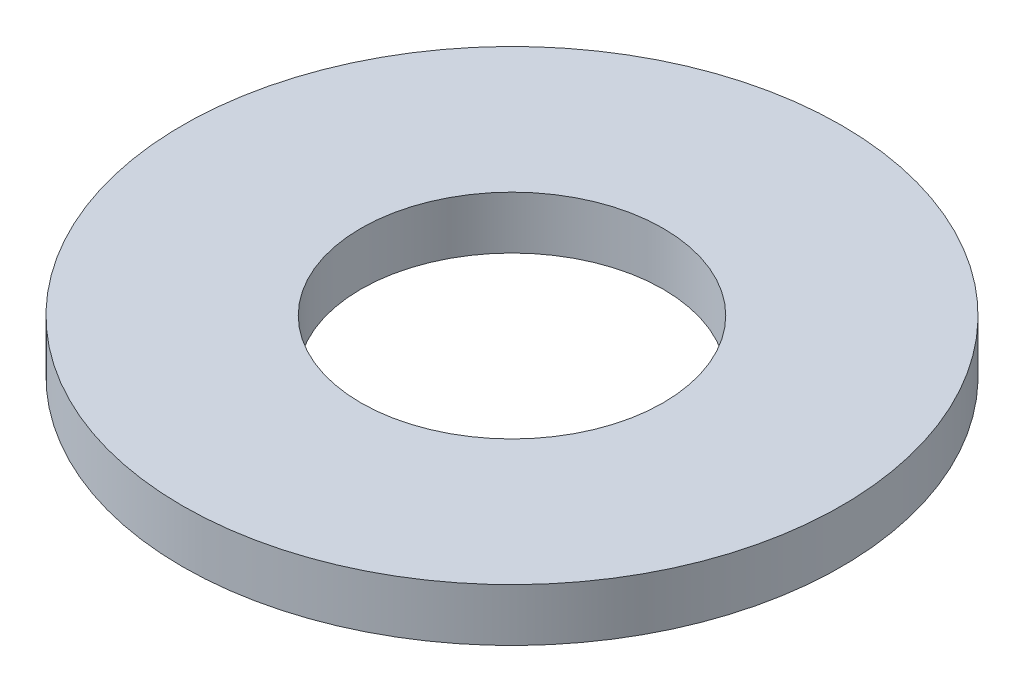
from build123d import *

# Parameters (mm, degrees)
SKETCH1_R           = 9.525
BOSS_EXTRUDE1_DEPTH = 1.524
SKETCH5_R           = 4.3688
CUT_EXTRUDE1_DEPTH  = 14.556320518


with BuildPart() as part:
    # Sketch1 → Boss-Extrude1 (new body)
    with BuildSketch(Plane(origin=(0, 0, 0), x_dir=(1, 0, 0), z_dir=(0, 1, 0))):
        with Locations(Location((0, 0, 0), (0, 0, 90))):
            Circle(SKETCH1_R)
    extrude(amount=BOSS_EXTRUDE1_DEPTH)

    # Sketch5 → Cut-Extrude1 (cut, through all)
    with BuildSketch(Plane(origin=(0, 1.524, 0), x_dir=(-1, 0, 0), z_dir=(0, 1, 0))):
        with Locations(Location((0, 0, 0), (0, 0, 90))):
            Circle(SKETCH5_R)
    extrude(amount=-CUT_EXTRUDE1_DEPTH, mode=Mode.SUBTRACT)


solid = part.part
